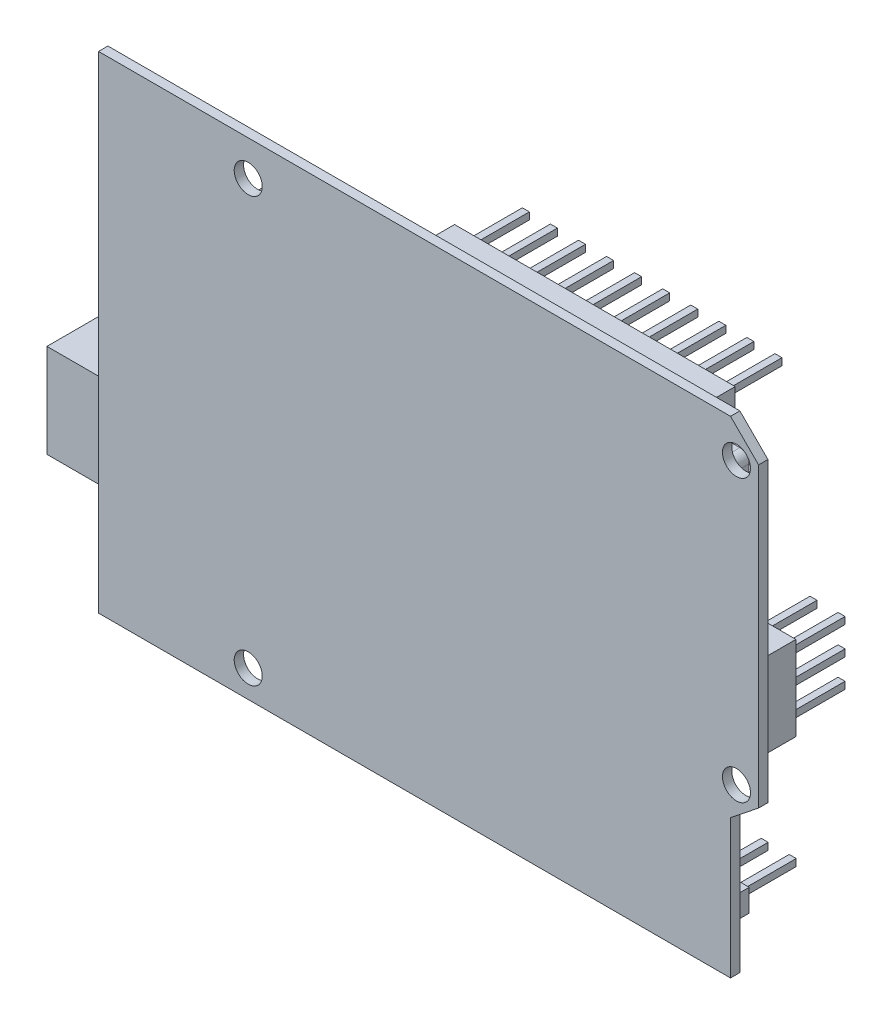
from build123d import *

# Parameters (mm, degrees)
BOSS_EXTRUDE1_DEPTH  = 1
SKETCH2_W            = 16
SKETCH2_H            = 10
BOSS_EXTRUDE2_DEPTH  = 10
SKETCH3_W            = 4.889113018
SKETCH3_H            = 5.37802432
CUT_EXTRUDE1_DEPTH   = 10
SKETCH4_W            = 45
SKETCH4_H            = 2.4
SKETCH4_W_2          = 30
BOSS_EXTRUDE3_DEPTH  = 4
SKETCH5_W            = 35
SKETCH5_H            = 10
BOSS_EXTRUDE4_DEPTH  = 7
SKETCH6_W            = 35
SKETCH6_H            = 1.5
CUT_EXTRUDE2_DEPTH   = 4
FILLET1_R            = 1
SKETCH7_R            = 1.5
CUT_EXTRUDE3_DEPTH   = 4
SKETCH8_W            = 0.75
SKETCH8_H            = 0.75
BOSS_EXTRUDE5_DEPTH  = 6
LPATTERN1_COUNT      = 10
LPATTERN1_PITCH      = 3
SKETCH9_W            = 0.75
SKETCH9_H            = 0.75
BOSS_EXTRUDE6_DEPTH  = 6
LPATTERN2_COUNT      = 15
LPATTERN2_PITCH      = 3
SKETCH10_R           = 2.5
BOSS_EXTRUDE7_DEPTH  = 6
SKETCH11_W           = 4.8
SKETCH11_H           = 9
BOSS_EXTRUDE8_DEPTH  = 4
SKETCH12_W           = 0.75
SKETCH12_H           = 0.75
BOSS_EXTRUDE9_DEPTH  = 6
LPATTERN3_COUNT      = 3
LPATTERN3_PITCH      = 3
LPATTERN3_COUNT_DIR2 = 2
LPATTERN3_PITCH_DIR2 = 3
SKETCH13_W           = 14.120912951
SKETCH13_H           = 4.362558473
BOSS_EXTRUDE10_DEPTH = 4
FILLET2_R            = 1


with BuildPart() as part:
    # Sketch1 → Boss-Extrude1 (new body)
    with BuildSketch(Plane.XY):
        Polygon((22.754016647, 124.270947632), (19.754016647, 127.270947632), (-47.799898806, 127.270947632), (-47.799898806, 75.270947632), (19.754016647, 75.270947632), (19.754016647, 90.113910289), (22.754016647, 92.500164177), align=None)
    extrude(amount=-BOSS_EXTRUDE1_DEPTH)

    # Sketch2 → Boss-Extrude2 (add)
    with BuildSketch(Plane(origin=(0, 0, -1), x_dir=(-1, 0, 0), z_dir=(0, 0, -1))):
        with Locations((46.316496684, 91.208096568)):
            Rectangle(SKETCH2_W, SKETCH2_H)
    extrude(amount=BOSS_EXTRUDE2_DEPTH)

    # Sketch3 → Cut-Extrude1 (cut)
    with BuildSketch(Plane.ZY.offset(54.316496684)):
        with Locations((-6.06540843, 91.2419286)):
            Rectangle(SKETCH3_W, SKETCH3_H)
    extrude(amount=-CUT_EXTRUDE1_DEPTH, mode=Mode.SUBTRACT)

    # Sketch4 → Boss-Extrude3 (add)
    with BuildSketch(Plane(origin=(0, 0, -1), x_dir=(-1, 0, 0), z_dir=(0, 0, -1))):
        with Locations((5.745983353, 78.470947632)):
            Rectangle(SKETCH4_W, SKETCH4_H)
        with Locations((-0.254016647, 124.070947632)):
            Rectangle(SKETCH4_W_2, SKETCH4_H)
    extrude(amount=BOSS_EXTRUDE3_DEPTH)

    # Sketch5 → Boss-Extrude4 (add)
    with BuildSketch(Plane(origin=(0, 0, -1), x_dir=(-1, 0, 0), z_dir=(0, 0, -1))):
        with Locations((3.745983353, 113.370947632)):
            Rectangle(SKETCH5_W, SKETCH5_H)
    extrude(amount=BOSS_EXTRUDE4_DEPTH)

    # Sketch6 → Cut-Extrude2 (cut)
    with BuildSketch(Plane(origin=(0, 0, -8), x_dir=(-1, 0, 0), z_dir=(0, 0, -1))):
        with Locations((3.745983353, 117.620947632)):
            Rectangle(SKETCH6_W, SKETCH6_H)
        with Locations((3.745983353, 109.120947632)):
            Rectangle(SKETCH6_W, SKETCH6_H)
    extrude(amount=-CUT_EXTRUDE2_DEPTH, mode=Mode.SUBTRACT)

    # Fillet1
    fillet1_edges = [part.edges().sort_by_distance(p)[0] for p in [
        (13.754016647, 109.870947632, -6),
        (-21.245983353, 109.870947632, -6),
        (13.754016647, 116.870947632, -6),
        (-21.245983353, 116.870947632, -6),
    ]]
    fillet(fillet1_edges, radius=FILLET1_R)

    # Sketch7 → Cut-Extrude3 (cut)
    with BuildSketch(Plane(origin=(0, 0, -1), x_dir=(-1, 0, 0), z_dir=(0, 0, -1))):
        with Locations((-20.390504743, 123.506772987)):
            Circle(SKETCH7_R)
        with Locations((-20.390504743, 93.48031176)):
            Circle(SKETCH7_R)
        with Locations((31.799898806, 123.506772987)):
            Circle(SKETCH7_R)
        with Locations((31.799898806, 78.192140702)):
            Circle(SKETCH7_R)
    extrude(amount=-CUT_EXTRUDE3_DEPTH, mode=Mode.SUBTRACT)

    # Sketch8 → Boss-Extrude5 (add)
    with BuildSketch(Plane(origin=(0, 0, -5), x_dir=(-1, 0, 0), z_dir=(0, 0, -1))):
        with Locations((-13.879016647, 124.070947632)):
            Rectangle(SKETCH8_W, SKETCH8_H)
    boss_extrude5 = extrude(amount=BOSS_EXTRUDE5_DEPTH)

    # LPattern1: Boss-Extrude5 ×10
    with Locations(*[(-i * LPATTERN1_PITCH, 0, 0) for i in range(1, LPATTERN1_COUNT)]):
        add(boss_extrude5)

    # Sketch9 → Boss-Extrude6 (add)
    with BuildSketch(Plane(origin=(0, 0, -5), x_dir=(-1, 0, 0), z_dir=(0, 0, -1))):
        with Locations((-15.402792453, 78.470947632)):
            Rectangle(SKETCH9_W, SKETCH9_H)
    boss_extrude6 = extrude(amount=BOSS_EXTRUDE6_DEPTH)

    # LPattern2: Boss-Extrude6 ×15
    with Locations(*[(-i * LPATTERN2_PITCH, 0, 0) for i in range(1, LPATTERN2_COUNT)]):
        add(boss_extrude6)

    # Sketch10 → Boss-Extrude7 (add)
    with BuildSketch(Plane(origin=(0, 0, -1), x_dir=(-1, 0, 0), z_dir=(0, 0, -1))):
        with Locations(Location((26.546732083, 118.214976991, 0), (0, 0, 180))):
            Circle(SKETCH10_R)
        with Locations(Location((31.940661119, 118.214976991, 0), (0, 0, 180))):
            Circle(SKETCH10_R)
    extrude(amount=BOSS_EXTRUDE7_DEPTH)

    # Sketch11 → Boss-Extrude8 (add)
    with BuildSketch(Plane(origin=(0, 0, -1), x_dir=(-1, 0, 0), z_dir=(0, 0, -1))):
        with Locations((-19.349242758, 100.613910289)):
            Rectangle(SKETCH11_W, SKETCH11_H)
    extrude(amount=BOSS_EXTRUDE8_DEPTH)

    # Sketch12 → Boss-Extrude9 (add)
    with BuildSketch(Plane(origin=(0, 0, -5), x_dir=(-1, 0, 0), z_dir=(0, 0, -1))):
        with Locations((-20.624242758, 97.488910289)):
            Rectangle(SKETCH12_W, SKETCH12_H)
    boss_extrude9 = extrude(amount=BOSS_EXTRUDE9_DEPTH)

    # LPattern3: Boss-Extrude9 3 × 2
    with Locations(*[(-j * LPATTERN3_PITCH_DIR2, i * LPATTERN3_PITCH, 0) for i in range(LPATTERN3_COUNT) for j in range(LPATTERN3_COUNT_DIR2) if (i, j) != (0, 0)]):
        add(boss_extrude9)

    # Sketch13 → Boss-Extrude10 (add)
    with BuildSketch(Plane(origin=(0, 0, -1), x_dir=(-1, 0, 0), z_dir=(0, 0, -1))):
        with Locations((23.447660741, 101.747194556)):
            Rectangle(SKETCH13_W, SKETCH13_H)
    extrude(amount=BOSS_EXTRUDE10_DEPTH)

    # Fillet2
    fillet2_edges = [part.edges().sort_by_distance(p)[0] for p in [
        (-16.387204265, 103.928473792, -3),
        (-16.387204265, 99.565915319, -3),
        (-30.508117216, 99.565915319, -3),
        (-30.508117216, 103.928473792, -3),
    ]]
    fillet(fillet2_edges, radius=FILLET2_R)


solid = part.part
